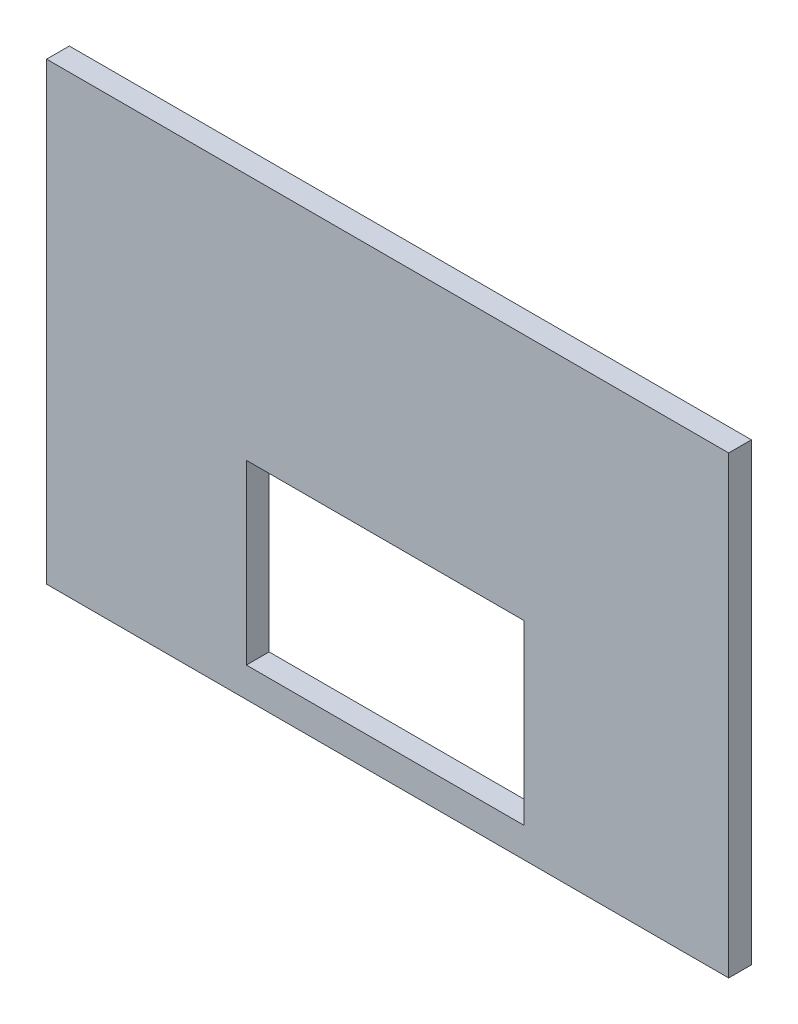
from build123d import *

# Parameters (mm, degrees)
SKETCH1_W           = 300
SKETCH1_H           = 200
SKETCH1_W_2         = 122
SKETCH1_H_2         = 78
BOSS_EXTRUDE1_DEPTH = 10


with BuildPart() as part:
    # Sketch1 → Boss-Extrude1 (new body)
    with BuildSketch(Plane.XY):
        with Locations((95.569620253, 31.329113924)):
            Rectangle(SKETCH1_W, SKETCH1_H)
        with Locations((94.443037975, -16.53164557)):
            Rectangle(SKETCH1_W_2, SKETCH1_H_2, mode=Mode.SUBTRACT)
    extrude(amount=BOSS_EXTRUDE1_DEPTH)


solid = part.part
